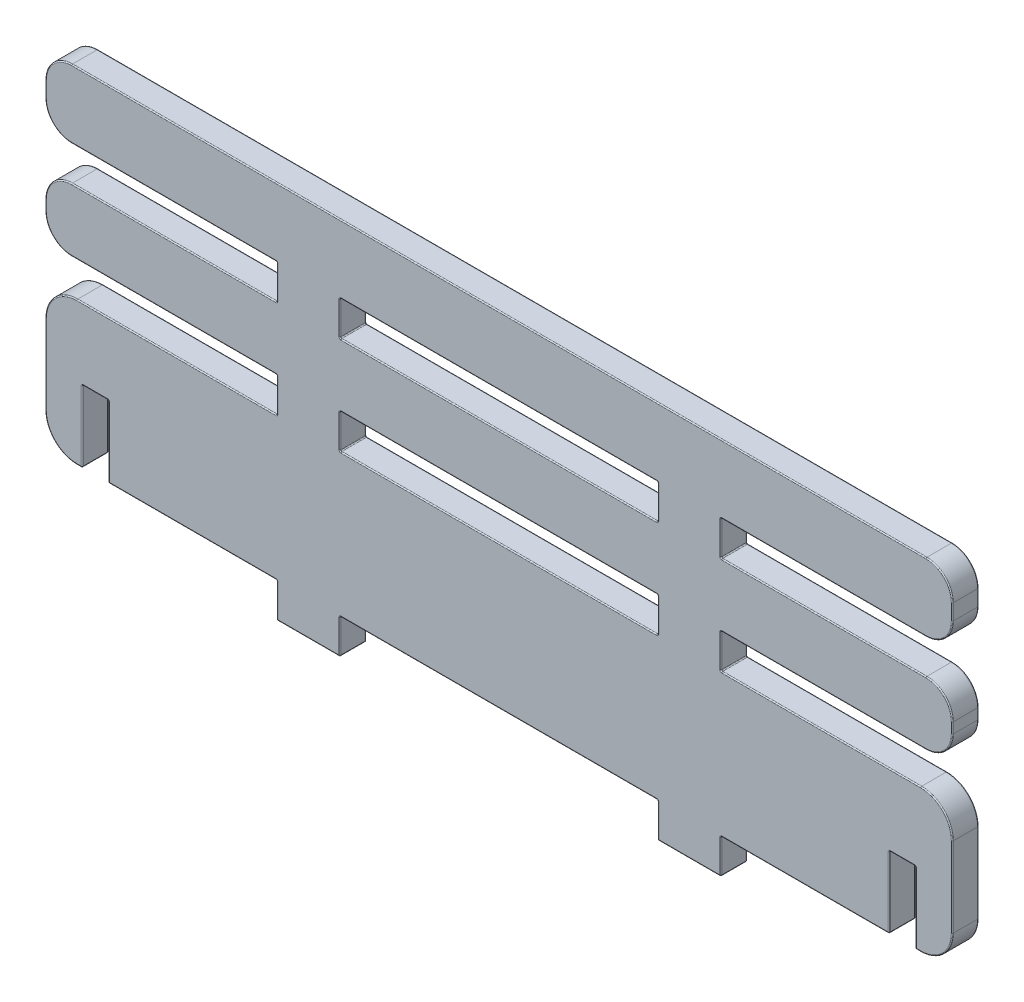
from build123d import *

# Parameters (mm, degrees)
ESBO_O1_W                = 86.2
ESBO_O1_H                = 6.5
ESBO_O1_W_2              = 6
ESBO_O1_H_2              = 3.3
RESSALTO_EXTRUS_O1_DEPTH = 2.5
FILETE1_R                = 2.5
FILETE2_R                = 0.1


with BuildPart() as part:
    # Esboço1 → Ressalto-extrusão1 (new body)
    with BuildSketch(Plane.XY):
        with Locations((-156.197641475, 115.769139873)):
            Rectangle(ESBO_O1_W, ESBO_O1_H)
        Polygon((-199.297641475, 103.219139873), (-177.297641475, 103.219139873), (-171.297641475, 103.219139873), (-141.097641475, 103.219139873), (-135.097641475, 103.219139873), (-113.097641475, 103.219139873), (-113.097641475, 109.219139873), (-135.097641475, 109.219139873), (-141.097641475, 109.219139873), (-171.297641475, 109.219139873), (-177.297641475, 109.219139873), (-199.297641475, 109.219139873), align=None)
        with BuildLine():
            Line((-193.297641475, 86.319139873), (-177.297641475, 86.319139873))
            Line((-177.297641475, 86.319139873), (-171.297641475, 86.319139873))
            Line((-171.297641475, 86.319139873), (-141.097641475, 86.319139873))
            Line((-141.097641475, 86.319139873), (-135.097641475, 86.319139873))
            Line((-135.097641475, 86.319139873), (-119.097641475, 86.319139873))
            Line((-119.097641475, 86.319139873), (-119.097641475, 93.119139873))
            Line((-119.097641475, 93.119139873), (-116.597641475, 93.119139873))
            Line((-116.597641475, 93.119139873), (-116.597641475, 86.319139873))
            Line((-116.597641475, 86.319139873), (-116.097641475, 86.319139873))
            ThreePointArc((-116.097641475, 86.319139873), (-113.976321131, 87.197819529), (-113.097641475, 89.319139873))
            Line((-113.097641475, 89.319139873), (-113.097641475, 96.919139873))
            ThreePointArc((-113.097641475, 96.919139873), (-113.976321131, 99.040460216), (-116.097641475, 99.919139873))
            Line((-116.097641475, 99.919139873), (-135.097641475, 99.919139873))
            Line((-135.097641475, 99.919139873), (-141.097641475, 99.919139873))
            Line((-141.097641475, 99.919139873), (-171.297641475, 99.919139873))
            Line((-171.297641475, 99.919139873), (-177.297641475, 99.919139873))
            Line((-177.297641475, 99.919139873), (-196.297641475, 99.919139873))
            ThreePointArc((-196.297641475, 99.919139873), (-198.418961818, 99.040460216), (-199.297641475, 96.919139873))
            Line((-199.297641475, 96.919139873), (-199.297641475, 89.319139873))
            ThreePointArc((-199.297641475, 89.319139873), (-198.418961818, 87.197819529), (-196.297641475, 86.319139873))
            Line((-196.297641475, 86.319139873), (-195.797641475, 86.319139873))
            Line((-195.797641475, 86.319139873), (-195.797641475, 93.119139873))
            Line((-195.797641475, 93.119139873), (-193.297641475, 93.119139873))
            Line((-193.297641475, 93.119139873), (-193.297641475, 86.319139873))
        make_face()
        with Locations((-174.297641475, 110.869139873)):
            Rectangle(ESBO_O1_W_2, ESBO_O1_H_2)
        with Locations((-174.297641475, 101.569139873)):
            Rectangle(ESBO_O1_W_2, ESBO_O1_H_2)
        with Locations((-174.297641475, 84.669139873)):
            Rectangle(ESBO_O1_W_2, ESBO_O1_H_2)
        with Locations((-138.097641475, 84.669139873)):
            Rectangle(ESBO_O1_W_2, ESBO_O1_H_2)
        with Locations((-138.097641475, 101.569139873)):
            Rectangle(ESBO_O1_W_2, ESBO_O1_H_2)
        with Locations((-138.097641475, 110.869139873)):
            Rectangle(ESBO_O1_W_2, ESBO_O1_H_2)
    extrude(amount=RESSALTO_EXTRUS_O1_DEPTH)

    # Filete1
    filete1_edges = [part.edges().sort_by_distance(p)[0] for p in [
        (-199.297641475, 103.219139873, 1.25),
        (-199.297641475, 109.219139873, 1.25),
        (-199.297641475, 112.519139873, 1.25),
        (-199.297641475, 119.019139873, 1.25),
        (-113.097641475, 119.019139873, 1.25),
        (-113.097641475, 112.519139873, 1.25),
        (-113.097641475, 109.219139873, 1.25),
        (-113.097641475, 103.219139873, 1.25),
    ]]
    fillet(filete1_edges, radius=FILETE1_R)

    # Filete2
    filete2_edges = [part.edges().sort_by_distance(p)[0] for p in [
        (-127.097641475, 86.319139873, 2.5),
        (-119.097641475, 89.719139873, 2.5),
        (-117.847641475, 93.119139873, 2.5),
        (-116.597641475, 89.719139873, 2.5),
        (-116.347641475, 86.319139873, 2.5),
        (-141.097641475, 110.869139873, 2.5),
        (-113.976321131, 87.197819529, 2.5),
        (-113.097641475, 93.119139873, 2.5),
        (-113.976321131, 99.040460216, 2.5),
        (-125.597641475, 99.919139873, 2.5),
        (-135.097641475, 101.569139873, 2.5),
        (-125.347641475, 109.219139873, 2.5),
        (-135.097641475, 110.869139873, 2.5),
        (-199.297641475, 106.219139873, 0),
        (-187.047641475, 109.219139873, 0),
        (-199.297641475, 115.769139873, 0),
        (-156.197641475, 119.019139873, 0),
        (-113.097641475, 115.769139873, 0),
        (-156.197641475, 109.219139873, 2.5),
        (-125.347641475, 112.519139873, 0),
        (-113.097641475, 106.219139873, 0),
        (-125.347641475, 103.219139873, 0),
        (-113.829874522, 118.286906826, 0),
        (-113.829874522, 113.25137292, 0),
        (-113.829874522, 108.486906826, 0),
        (-113.829874522, 103.95137292, 0),
        (-198.565408428, 118.286906826, 0),
        (-198.565408428, 108.486906826, 0),
        (-198.565408428, 113.25137292, 0),
        (-198.565408428, 103.95137292, 0),
        (-199.297641475, 106.219139873, 2.5),
        (-125.347641475, 103.219139873, 2.5),
        (-113.097641475, 106.219139873, 2.5),
        (-125.347641475, 112.519139873, 2.5),
        (-113.097641475, 115.769139873, 2.5),
        (-156.197641475, 119.019139873, 2.5),
        (-199.297641475, 115.769139873, 2.5),
        (-187.047641475, 112.519139873, 2.5),
        (-187.047641475, 109.219139873, 2.5),
        (-113.829874522, 118.286906826, 2.5),
        (-113.829874522, 113.25137292, 2.5),
        (-113.829874522, 108.486906826, 2.5),
        (-113.829874522, 103.95137292, 2.5),
        (-177.297641475, 110.869139873, 2.5),
        (-198.565408428, 118.286906826, 2.5),
        (-198.565408428, 108.486906826, 2.5),
        (-198.565408428, 113.25137292, 2.5),
        (-198.565408428, 103.95137292, 2.5),
        (-187.047641475, 103.219139873, 2.5),
        (-177.297641475, 101.569139873, 2.5),
        (-186.797641475, 99.919139873, 2.5),
        (-198.418961818, 99.040460216, 2.5),
        (-199.297641475, 93.119139873, 2.5),
        (-171.297641475, 110.869139873, 2.5),
        (-156.197641475, 103.219139873, 2.5),
        (-141.097641475, 101.569139873, 2.5),
        (-156.197641475, 99.919139873, 2.5),
        (-171.297641475, 101.569139873, 2.5),
        (-198.418961818, 87.197819529, 2.5),
        (-199.297641475, 93.119139873, 0),
        (-198.418961818, 99.040460216, 0),
        (-186.797641475, 99.919139873, 0),
        (-177.297641475, 101.569139873, 0),
        (-187.047641475, 103.219139873, 0),
        (-196.047641475, 86.319139873, 2.5),
        (-177.297641475, 110.869139873, 0),
        (-187.047641475, 112.519139873, 0),
        (-195.797641475, 89.719139873, 2.5),
        (-135.097641475, 110.869139873, 0),
        (-125.347641475, 109.219139873, 0),
        (-135.097641475, 101.569139873, 0),
        (-194.547641475, 93.119139873, 2.5),
        (-125.597641475, 99.919139873, 0),
        (-113.976321131, 99.040460216, 0),
        (-113.097641475, 93.119139873, 0),
        (-113.976321131, 87.197819529, 0),
        (-156.197641475, 112.519139873, 2.5),
        (-116.347641475, 86.319139873, 0),
        (-116.597641475, 89.719139873, 0),
        (-117.847641475, 93.119139873, 0),
        (-119.097641475, 89.719139873, 0),
        (-193.297641475, 89.719139873, 2.5),
        (-127.097641475, 86.319139873, 0),
        (-135.097641475, 84.669139873, 0),
        (-138.097641475, 83.019139873, 0),
        (-141.097641475, 84.669139873, 0),
        (-156.197641475, 86.319139873, 0),
        (-171.297641475, 84.669139873, 0),
        (-174.297641475, 83.019139873, 0),
        (-185.297641475, 86.319139873, 2.5),
        (-177.297641475, 84.669139873, 0),
        (-185.297641475, 86.319139873, 0),
        (-193.297641475, 89.719139873, 0),
        (-194.547641475, 93.119139873, 0),
        (-195.797641475, 89.719139873, 0),
        (-196.047641475, 86.319139873, 0),
        (-198.418961818, 87.197819529, 0),
        (-171.297641475, 101.569139873, 0),
        (-156.197641475, 99.919139873, 0),
        (-177.297641475, 84.669139873, 2.5),
        (-141.097641475, 101.569139873, 0),
        (-156.197641475, 103.219139873, 0),
        (-171.297641475, 110.869139873, 0),
        (-156.197641475, 109.219139873, 0),
        (-141.097641475, 110.869139873, 0),
        (-156.197641475, 112.519139873, 0),
        (-174.297641475, 83.019139873, 2.5),
        (-171.297641475, 84.669139873, 2.5),
        (-156.197641475, 86.319139873, 2.5),
        (-177.297641475, 99.919139873, 1.25),
        (-177.297641475, 103.219139873, 1.25),
        (-177.297641475, 109.219139873, 1.25),
        (-141.097641475, 84.669139873, 2.5),
        (-177.297641475, 112.519139873, 1.25),
        (-135.097641475, 112.519139873, 1.25),
        (-135.097641475, 109.219139873, 1.25),
        (-135.097641475, 103.219139873, 1.25),
        (-135.097641475, 99.919139873, 1.25),
        (-116.597641475, 86.319139873, 1.25),
        (-116.597641475, 93.119139873, 1.25),
        (-119.097641475, 93.119139873, 1.25),
        (-119.097641475, 86.319139873, 1.25),
        (-135.097641475, 86.319139873, 1.25),
        (-135.097641475, 83.019139873, 1.25),
        (-141.097641475, 83.019139873, 1.25),
        (-141.097641475, 86.319139873, 1.25),
        (-171.297641475, 86.319139873, 1.25),
        (-171.297641475, 83.019139873, 1.25),
        (-177.297641475, 83.019139873, 1.25),
        (-177.297641475, 86.319139873, 1.25),
        (-193.297641475, 86.319139873, 1.25),
        (-193.297641475, 93.119139873, 1.25),
        (-195.797641475, 93.119139873, 1.25),
        (-195.797641475, 86.319139873, 1.25),
        (-171.297641475, 103.219139873, 1.25),
        (-171.297641475, 99.919139873, 1.25),
        (-141.097641475, 99.919139873, 1.25),
        (-141.097641475, 103.219139873, 1.25),
        (-171.297641475, 112.519139873, 1.25),
        (-171.297641475, 109.219139873, 1.25),
        (-141.097641475, 109.219139873, 1.25),
        (-141.097641475, 112.519139873, 1.25),
        (-138.097641475, 83.019139873, 2.5),
        (-135.097641475, 84.669139873, 2.5),
    ]]
    fillet(filete2_edges, radius=FILETE2_R)


solid = part.part
